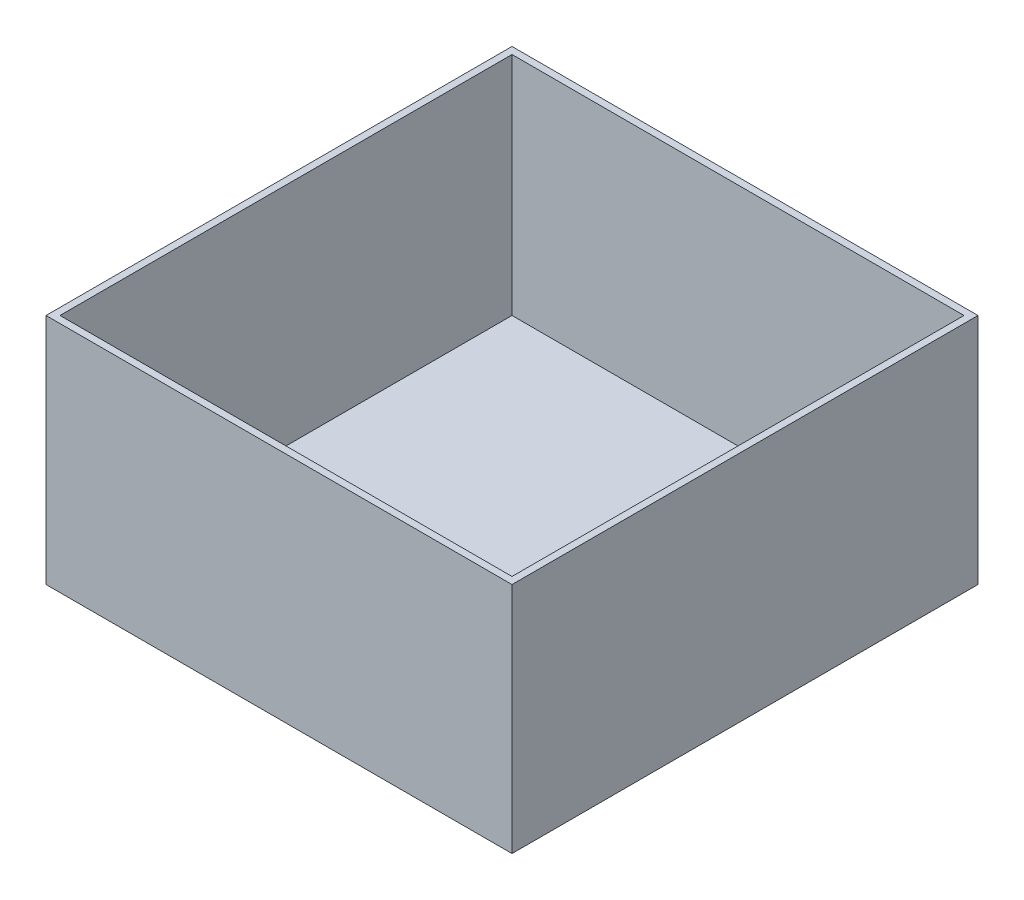
from build123d import *

# Parameters (mm, degrees)
SKETCH1_W           = 200
SKETCH1_H           = 200
BOSS_EXTRUDE1_DEPTH = 100
SKETCH2_W           = 194
SKETCH2_H           = 194
CUT_EXTRUDE1_DEPTH  = 97


with BuildPart() as part:
    # Sketch1 → Boss-Extrude1 (new body)
    with BuildSketch(Plane(origin=(0, 0, 0), x_dir=(1, 0, 0), z_dir=(0, 1, 0))):
        Rectangle(SKETCH1_W, SKETCH1_H)
    extrude(amount=BOSS_EXTRUDE1_DEPTH)

    # Sketch2 → Cut-Extrude1 (cut)
    with BuildSketch(Plane(origin=(0, 100, 0), x_dir=(1, 0, 0), z_dir=(0, 1, 0))):
        Rectangle(SKETCH2_W, SKETCH2_H)
    extrude(amount=-CUT_EXTRUDE1_DEPTH, mode=Mode.SUBTRACT)


solid = part.part
